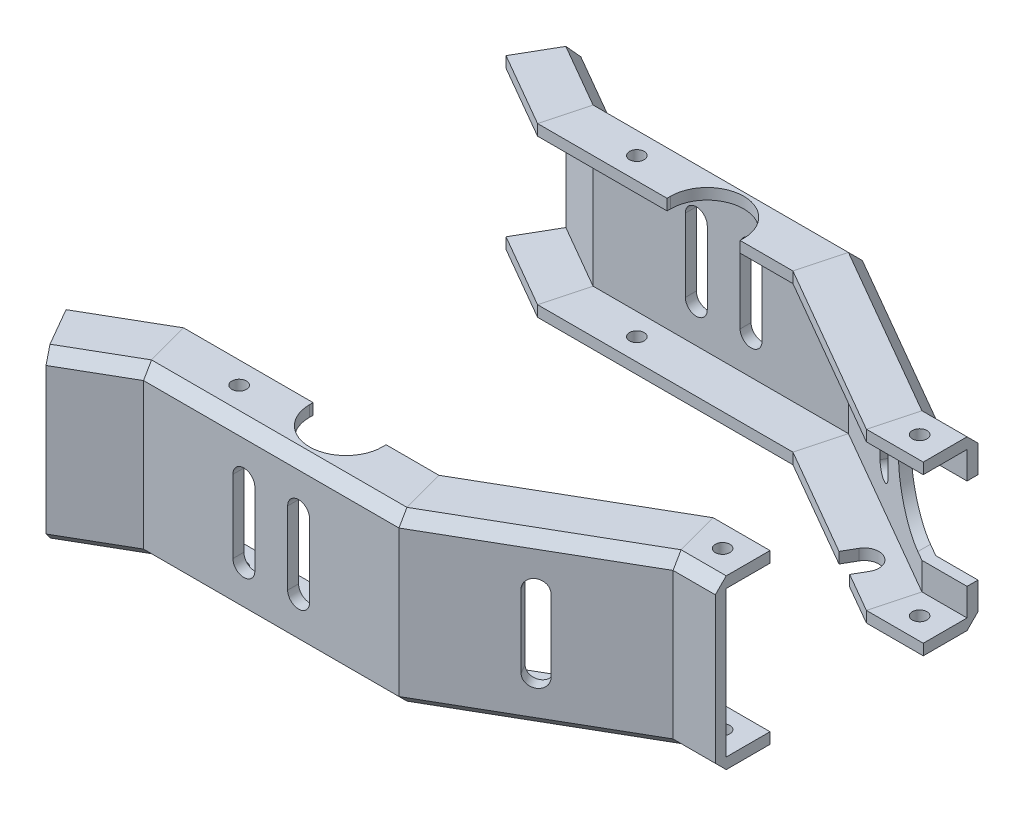
from build123d import *

# Parameters (mm, degrees)
CUT_EXTRUDE3_DEPTH      = 5
CUT_EXTRUDE4_DEPTH      = 10
CHAMFER1_SIZE           = 3
CUT_EXTRUDE6_DEPTH      = 3
F_4_0MM_DOWEL_HOLE2_D   = 4
CUT_EXTRUDE9_DEPTH      = 10
CUT_EXTRUDE7_DEPTH      = 146.985046122
CUT_EXTRUDE7_DEPTH_BACK = 5


with BuildPart() as part:
    # Sweep8: sweep along a path in Sketch6
    with BuildLine(Plane(origin=(0, 0, 0), x_dir=(1, 0, 0), z_dir=(0, 1, 0))) as sweep8_path:
        Line((-87.320508076, -10), (-70, 0))
        Line((-70, 0), (0, 0))
        Line((0, 0), (47.631397208, 27.5))
        Line((47.631397208, 27.5), (59.631397208, 27.5))
    # Sketch7 → Sweep8 (sweep)
    with BuildSketch(Plane(origin=(0, 0, 0), x_dir=(0, 0, -1), z_dir=(1, 0, 0))):
        Polygon((-1.604651163, -23), (-1.604651163, 23), (13.395348837, 23), (13.395348837, 20), (1.395348837, 20), (1.395348837, -20), (13.395348837, -20), (13.395348837, -23), align=None)
    sweep(path=sweep8_path.line, transition=Transition.RIGHT)

    # Sketch10 → Cut-Extrude3 (cut)
    with BuildSketch(Plane(origin=(0, 23, 0), x_dir=(1, 0, 0), z_dir=(0, 1, 0))):
        with BuildLine():
            Line((-38.089272903, 13.395348837), (-18.089272903, 13.395348837))
            Line((-18.089272903, 13.395348837), (-18.089272903, 12.395348837))
            ThreePointArc((-18.089272903, 12.395348837), (-28.089272903, 2.395348837), (-38.089272903, 12.395348837))
            Line((-38.089272903, 12.395348837), (-38.089272903, 13.395348837))
        make_face()
    extrude(amount=-CUT_EXTRUDE3_DEPTH, mode=Mode.SUBTRACT)

    # Sketch11 → Cut-Extrude4 (cut)
    with BuildSketch(Plane.XY.offset(1.604651163)):
        with BuildLine():
            Line((-45.070035017, -10), (-45.070035017, 10))
            ThreePointArc((-45.070035017, 10), (-42.070035017, 13), (-39.070035017, 10))
            Line((-39.070035017, 10), (-39.070035017, -10))
            ThreePointArc((-39.070035017, -10), (-42.070035017, -13), (-45.070035017, -10))
        make_face()
        with BuildLine():
            Line((-24.070035017, -10), (-24.070035017, 10))
            ThreePointArc((-24.070035017, 10), (-27.070035017, 13), (-30.070035017, 10))
            Line((-30.070035017, 10), (-30.070035017, -10))
            ThreePointArc((-30.070035017, -10), (-27.070035017, -13), (-24.070035017, -10))
        make_face()
    extrude(amount=-CUT_EXTRUDE4_DEPTH, mode=Mode.SUBTRACT)

    # Chamfer1
    chamfer1_edges = [part.edges().sort_by_distance(p)[0] for p in [
        (-78.044108756, -23, 6.497159917),
        (-34.570035017, -23, 1.604651163),
        (24.245663587, -23, -12.145348837),
        (-78.044108756, 23, 6.497159917),
        (-34.570035017, 23, 1.604651163),
        (24.245663587, 23, -12.145348837),
        (53.8463797, -23, -25.895348837),
        (53.8463797, 23, -25.895348837),
    ]]
    chamfer(chamfer1_edges, length=CHAMFER1_SIZE)

    # Sketch14 → Cut-Extrude6 (cut)
    with BuildSketch(Plane(origin=(0.802325581, 0, 1.389668671), x_dir=(0.8660254037844379, 0, -0.5000000000000014), z_dir=(0.5000000000000014, 0, 0.8660254037844379))):
        with BuildLine():
            Line((24.070035017, -10), (24.070035017, 10))
            ThreePointArc((24.070035017, 10), (27.070035017, 13), (30.070035017, 10))
            Line((30.070035017, 10), (30.070035017, -10))
            ThreePointArc((30.070035017, -10), (27.070035017, -13), (24.070035017, -10))
        make_face()
    extrude(amount=-CUT_EXTRUDE6_DEPTH, mode=Mode.SUBTRACT)

    # Ø4.0mm Dowel Hole2 (through all)
    with Locations(Plane(origin=(0, -23, 0), x_dir=(-1, 0, 0), z_dir=(0, -1, 0))):
        with Locations((52.368602792, 7.395348837), (-52.631397208, 34.895348837)):
            Hole(F_4_0MM_DOWEL_HOLE2_D / 2)

    # Sketch22 → Cut-Extrude9 (cut)
    with BuildSketch(Plane.XZ.offset(23)):
        with BuildLine():
            Line((28.288603527, -27.181247222), (26.288603527, -30.645348837))
            Line((26.288603527, -30.645348837), (33.216806758, -34.645348837))
            Line((33.216806758, -34.645348837), (35.216806758, -31.181247222))
            ThreePointArc((35.216806758, -31.181247222), (33.752705142, -25.717145607), (28.288603527, -27.181247222))
        make_face()
    extrude(amount=-CUT_EXTRUDE9_DEPTH, mode=Mode.SUBTRACT)


with BuildPart() as body_2:
    # Mirror2: mirrored copy
    add(part.part.mirror(Plane(origin=(0, 0, -61.895348837), x_dir=(1, 0, 0), z_dir=(0, 0, -1))))

    # Sketch20 → Cut-Extrude7 (cut, two sides: drawn at the far end of the back side and taken through both)
    with BuildSketch(Plane(origin=(0, 0, -97.895348837), x_dir=(-1, 0, 0), z_dir=(0, 0, -1)).offset(-CUT_EXTRUDE7_DEPTH_BACK)):
        with BuildLine():
            ThreePointArc((-44.631397208, -12.5), (-32.131397208, 0), (-44.631397208, 12.5))
            Line((-44.631397208, 12.5), (-59.631397208, 12.5))
            Line((-59.631397208, 12.5), (-59.631397208, -12.5))
            Line((-59.631397208, -12.5), (-44.631397208, -12.5))
        make_face()
    extrude(amount=CUT_EXTRUDE7_DEPTH + CUT_EXTRUDE7_DEPTH_BACK, mode=Mode.SUBTRACT)


solid = Compound([part.part, body_2.part])
